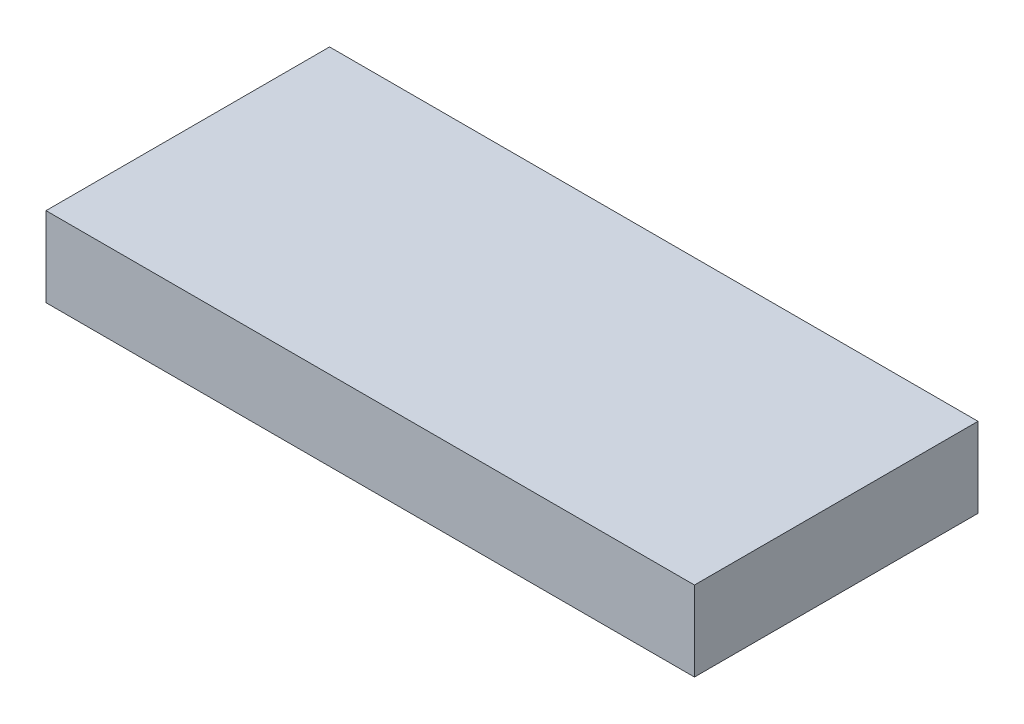
from build123d import *

# Parameters (mm, degrees)
ESQUISSE1_W        = 406.6
ESQUISSE1_H        = 177.8
BOSS_EXTRU_1_DEPTH = 50


with BuildPart() as part:
    # Esquisse1 → Boss.-Extru.1 (new body)
    with BuildSketch(Plane(origin=(0, 0, 0), x_dir=(1, 0, 0), z_dir=(0, 1, 0))):
        with Locations((203.3, 88.9)):
            Rectangle(ESQUISSE1_W, ESQUISSE1_H)
    extrude(amount=BOSS_EXTRU_1_DEPTH)


solid = part.part
